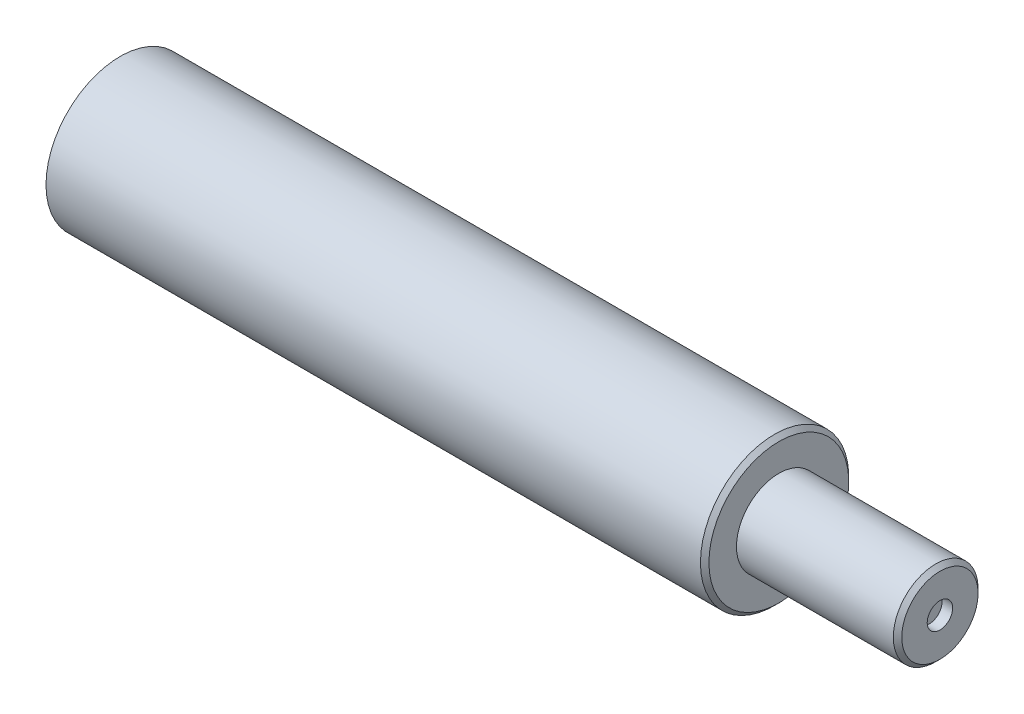
from build123d import *

# Parameters (mm, degrees)
CHAMFER1_SIZE      = 1
SKETCH2_R          = 2.5
CUT_EXTRUDE1_DEPTH = 27


with BuildPart() as part:
    # Sketch1 → Revolve1 (revolve)
    with BuildSketch(Plane.XY, mode=Mode.PRIVATE) as revolve1_sk:
        Polygon((190.9, 0), (190.9, 3), (193.4, 3), (193.4, 10), (155.4, 10), (155.4, 17.5), (0, 17.5), (0, 0), align=None)
    revolve(revolve1_sk.sketch.rotate(Axis((0, 0, 0), (1, 0, 0)), 90), axis=Axis((0, 0, 0), (1, 0, 0)))

    # Chamfer1
    chamfer1_edges = [part.edges().sort_by_distance(p)[0] for p in [
        (193.4, 0, -10),
        (155.4, 0, -17.5),
    ]]
    chamfer(chamfer1_edges, length=CHAMFER1_SIZE)

    # Sketch2 → Cut-Extrude1 (cut)
    with BuildSketch(Plane.ZY):
        with Locations((-7, 7)):
            Circle(SKETCH2_R)
        with Locations(Location((7, 7, 0), (0, 0, 180))):
            Circle(SKETCH2_R)
        with Locations((7, -7)):
            Circle(SKETCH2_R)
        with Locations(Location((-7, -7, 0), (0, 0, 180))):
            Circle(SKETCH2_R)
    extrude(amount=-CUT_EXTRUDE1_DEPTH, mode=Mode.SUBTRACT)


solid = part.part
